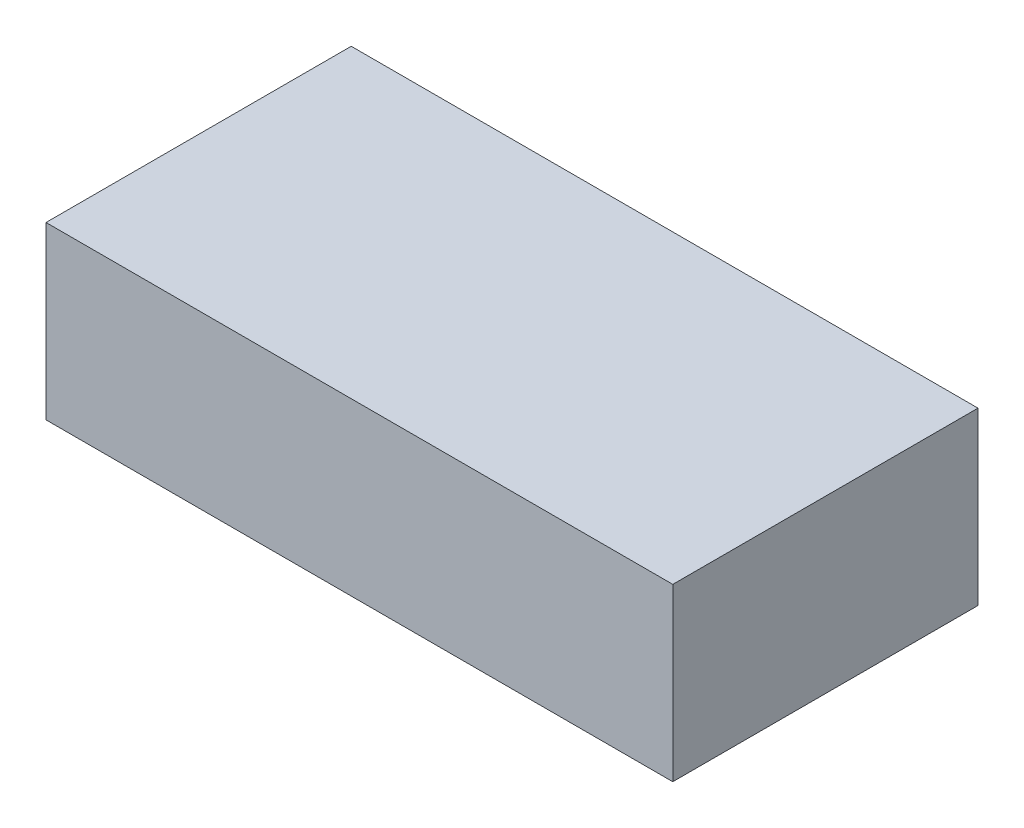
from build123d import *

# Parameters (mm, degrees)
SKETCH1_W           = 33
SKETCH1_H           = 9
BOSS_EXTRUDE1_DEPTH = 32.1390625
SKETCH2_W           = 33
SKETCH2_H           = 16.06953125
CUT_EXTRUDE1_DEPTH  = 47.935267533


with BuildPart() as part:
    # Sketch1 → Boss-Extrude1 (new body)
    with BuildSketch(Plane.XY):
        with Locations((16.5, 4.5)):
            Rectangle(SKETCH1_W, SKETCH1_H)
    extrude(amount=BOSS_EXTRUDE1_DEPTH)

    # Sketch2 → Cut-Extrude1 (cut, through all)
    with BuildSketch(Plane(origin=(0, 9, 0), x_dir=(1, 0, 0), z_dir=(0, 1, 0))):
        with Locations((16.5, -24.104296875)):
            Rectangle(SKETCH2_W, SKETCH2_H)
    extrude(amount=-CUT_EXTRUDE1_DEPTH, mode=Mode.SUBTRACT)


solid = part.part
